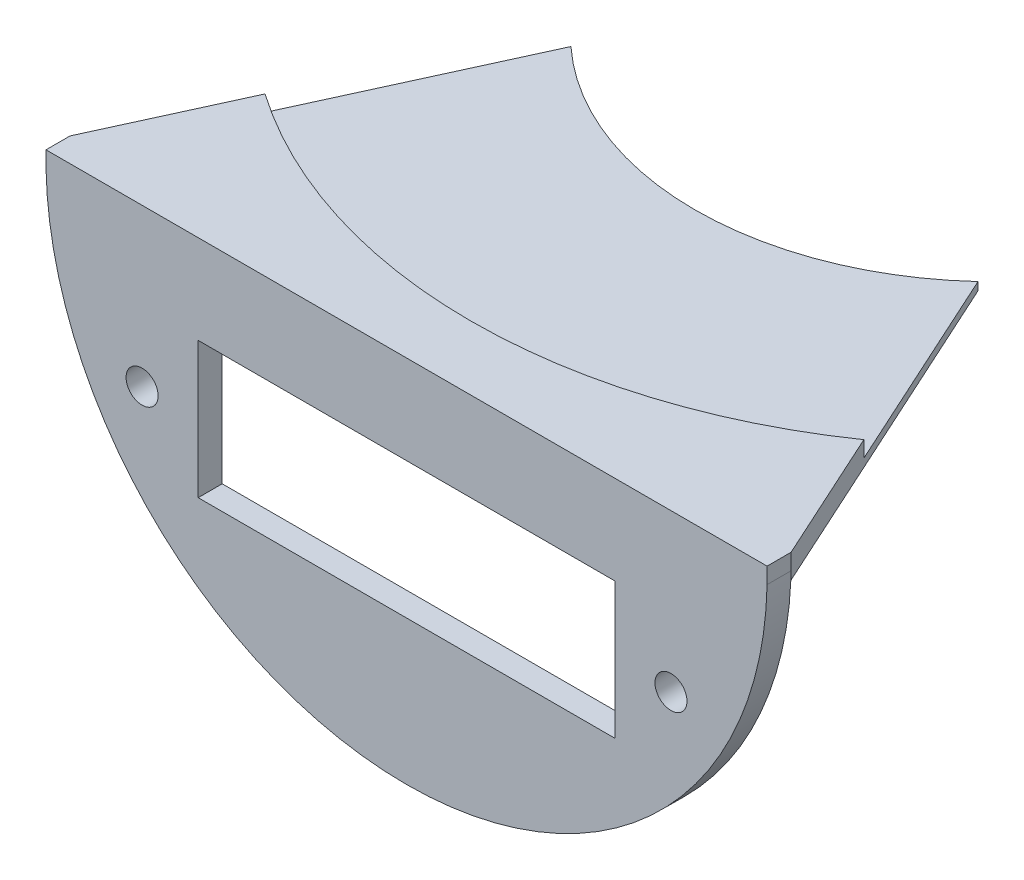
from build123d import *

# Parameters (mm, degrees)
SKETCH1_R           = 2
SKETCH1_W           = 52
SKETCH1_H           = 17
BOSS_EXTRUDE1_DEPTH = 3
BOSS_EXTRUDE2_DEPTH = 1
BOSS_EXTRUDE3_DEPTH = 2


with BuildPart() as part:
    # Sketch1 → Boss-Extrude1 (new body)
    with BuildSketch(Plane.XY):
        with BuildLine():
            Line((-44.9909991, 29.1), (44.9909991, 29.1))
            ThreePointArc((44.9909991, 29.1), (0, -15), (-44.9909991, 29.1))
        make_face()
        with Locations((-33, 11.5)):
            Circle(SKETCH1_R, mode=Mode.SUBTRACT)
        with Locations((33, 11.5)):
            Circle(SKETCH1_R, mode=Mode.SUBTRACT)
        with Locations((0, 11.5)):
            Rectangle(SKETCH1_W, SKETCH1_H, mode=Mode.SUBTRACT)
    extrude(amount=BOSS_EXTRUDE1_DEPTH)

    # Sketch4 → Boss-Extrude2 (add)
    with BuildSketch(Plane(origin=(0, 28.1, 0), x_dir=(1, 0, 0), z_dir=(0, 1, 0))):
        with BuildLine():
            Line((-25.4, 42.912140351), (-44.9909991, 0))
            Line((-44.9909991, 0), (44.9909991, 0))
            Line((44.9909991, 0), (25.4, 42.912140351))
            ThreePointArc((25.4, 42.912140351), (0, 33), (-25.4, 42.912140351))
        make_face()
    extrude(amount=BOSS_EXTRUDE2_DEPTH)

    # Sketch5 → Boss-Extrude3 (add)
    with BuildSketch(Plane(origin=(0, 29.1, 0), x_dir=(1, 0, 0), z_dir=(0, 1, 0))):
        with BuildLine():
            Line((-37.365311148, 16.703313087), (-44.9909991, 0))
            Line((-44.9909991, 0), (-44.9909991, -3))
            Line((-44.9909991, -3), (44.9909991, -3))
            Line((44.9909991, -3), (44.9909991, 0))
            Line((44.9909991, 0), (37.365311148, 16.703313087))
            ThreePointArc((37.365311148, 16.703313087), (0, 5), (-37.365311148, 16.703313087))
        make_face()
    extrude(amount=BOSS_EXTRUDE3_DEPTH)


solid = part.part
